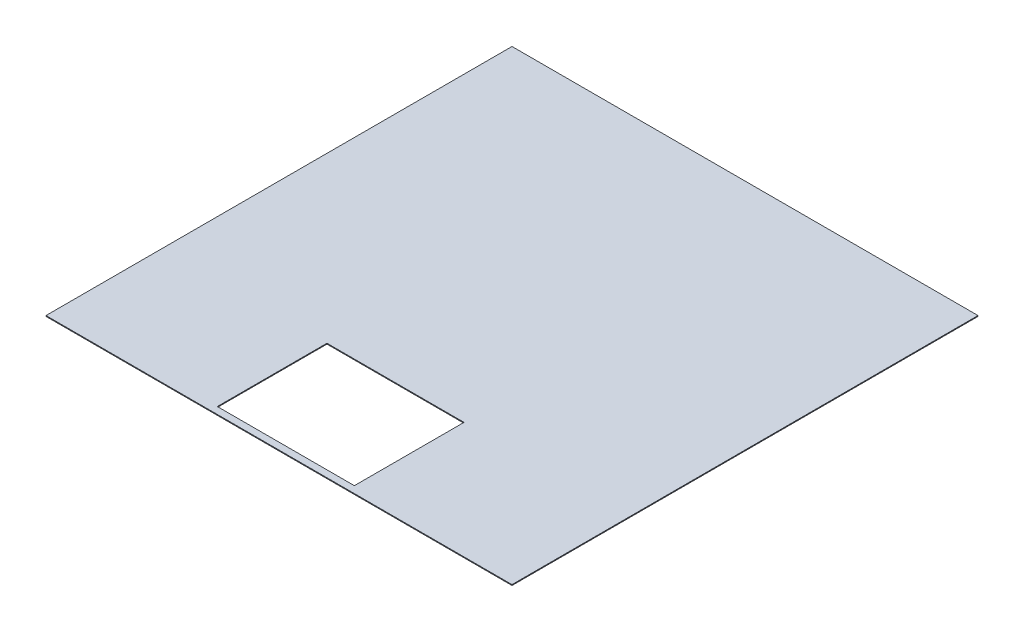
from build123d import *

# Parameters (mm, degrees)
SKETCH_1_W      = 340
SKETCH_1_H      = 340
SKETCH_1_W_2    = 100
SKETCH_1_H_2    = 80
EXTRUDE_1_DEPTH = 0.6


with BuildPart() as part:
    # 草图1 → 凸台-拉伸1 (new body)
    with BuildSketch(Plane(origin=(0, 0, 0), x_dir=(1, 0, 0), z_dir=(0, 1, 0))):
        with Locations((170, -170)):
            Rectangle(SKETCH_1_W, SKETCH_1_H)
        with Locations((170, -295)):
            Rectangle(SKETCH_1_W_2, SKETCH_1_H_2, mode=Mode.SUBTRACT)
    extrude(amount=EXTRUDE_1_DEPTH)


solid = part.part
